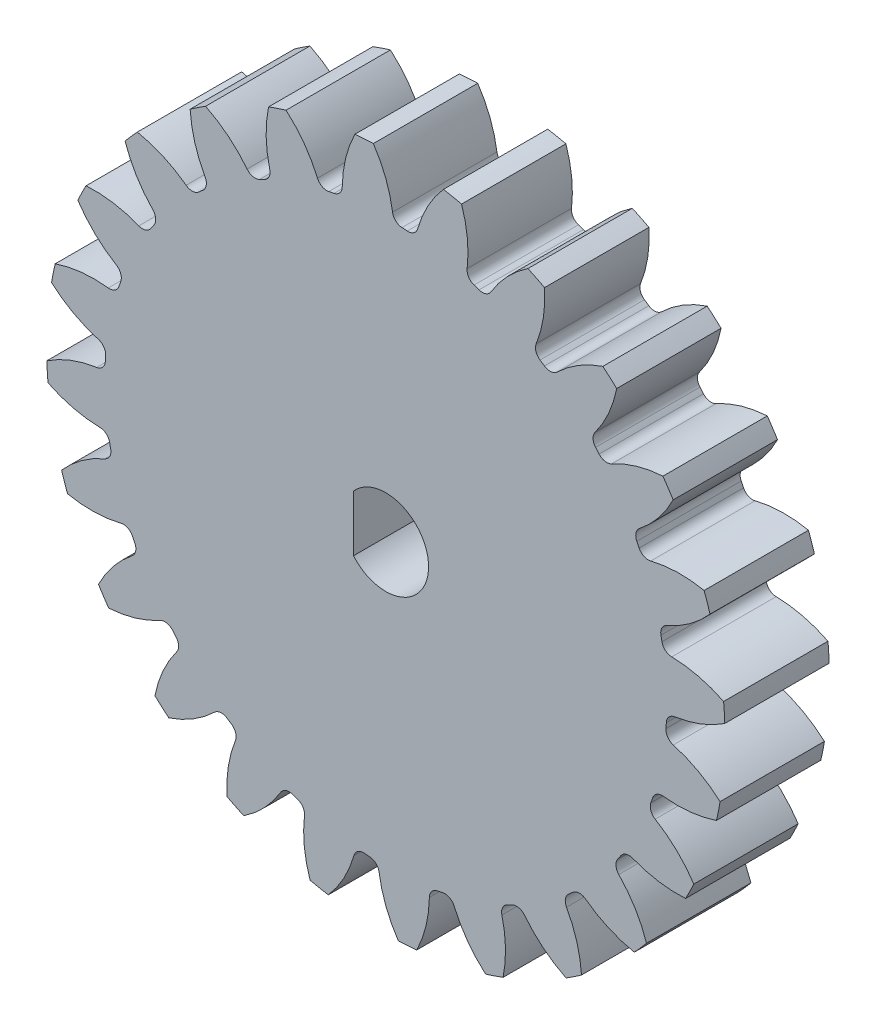
from build123d import *

# Parameters (mm, degrees)
SKETCH3_R          = 20.6375
GEARBODY_DEPTH     = 6.35
TOOTHCUT_DEPTH     = 30.868634259
CIRPATTERN1_COUNT  = 24
CUT_EXTRUDE1_DEPTH = 30.849477941


with BuildPart() as part:
    # Sketch3 → gearBody (new body)
    with BuildSketch(Plane.XY):
        Circle(SKETCH3_R)
    extrude(amount=GEARBODY_DEPTH)

    # Sketch2 → toothCut (cut, through all)
    with BuildSketch(Plane.XY):
        with BuildLine():
            ThreePointArc((17.04439181, -1.303986765), (17.05590718, -1.14354882), (17.065912391, -0.983009622))
            ThreePointArc((17.065912391, -0.983009622), (17.226475942, -0.603092534), (17.591114308, -0.410332293))
            ThreePointArc((17.591114308, -0.410332293), (20.42378314, 0.626979823), (22.599606758, 2.716434472))
            ThreePointArc((22.599606758, 2.716434472), (22.711286815, -1.522725526), (22.034703624, -5.709034773))
            ThreePointArc((22.034703624, -5.709034773), (20.157284273, -3.347822008), (17.488443939, -1.941649751))
            ThreePointArc((17.488443939, -1.941649751), (17.152801577, -1.701937731), (17.04439181, -1.303986765))
        make_face()
    toothcut = extrude(amount=TOOTHCUT_DEPTH, mode=Mode.SUBTRACT)

    # CirPattern1: toothCut ×24 about axis
    cirpattern1_axis = Axis((0, 0, 0), (0, 0, 1))
    for i in range(1, CIRPATTERN1_COUNT):
        add(toothcut.rotate(cirpattern1_axis, i * 360 / CIRPATTERN1_COUNT), mode=Mode.SUBTRACT)

    # Sketch4 → Cut-Extrude1 (cut, through all)
    with BuildSketch(Plane(origin=(0, 0, 0), x_dir=(-1, 0, 0), z_dir=(0, 0, -1))):
        with BuildLine():
            Line((1.9685, -1.703883799), (1.9685, 1.703883799))
            ThreePointArc((1.9685, 1.703883799), (-2.6035, 0), (1.9685, -1.703883799))
        make_face()
    extrude(amount=-CUT_EXTRUDE1_DEPTH, mode=Mode.SUBTRACT)


solid = part.part
